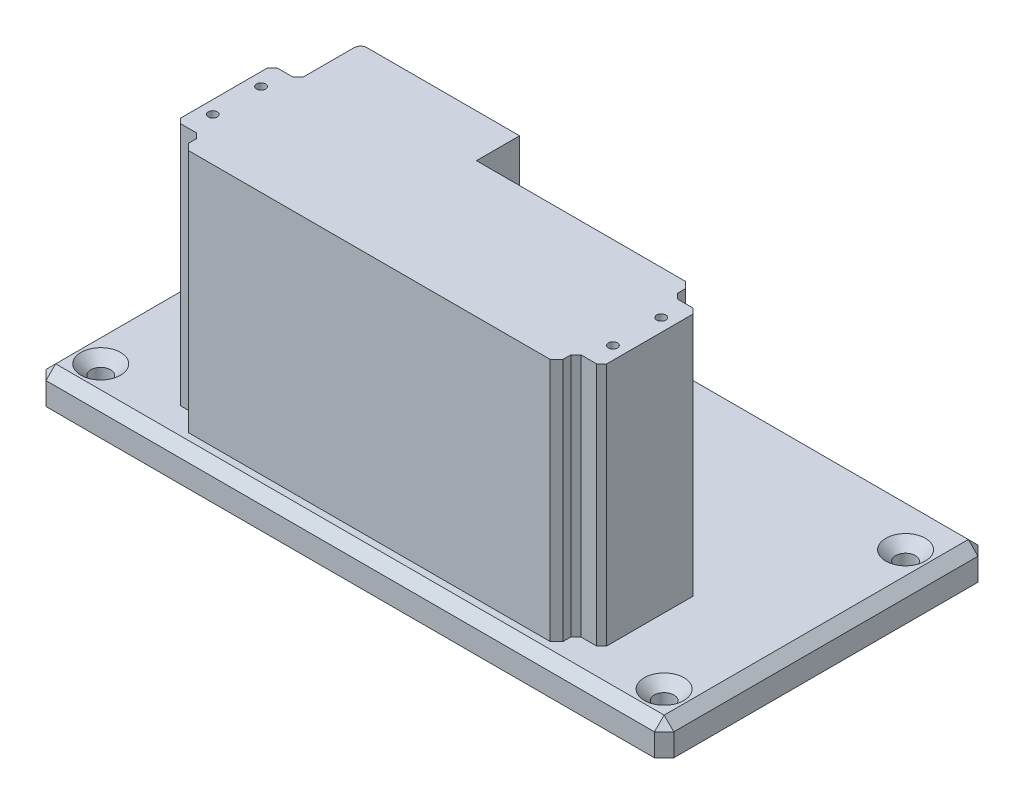
from build123d import *

# Parameters (mm, degrees)
SKETCH1_R           = 3.05
BOSS_EXTRUDE1_DEPTH = 10
BOSS_EXTRUDE2_DEPTH = 75.9
SKETCH3_R           = 1.4
CUT_EXTRUDE1_DEPTH  = 6
CHAMFER1_SIZE       = 1.55
CHAMFER2_SIZE       = 2
CHAMFER3_SIZE       = 3.1
CHAMFER4_SIZE       = 3


with BuildPart() as part:
    # Sketch1 → Boss-Extrude1 (new body)
    with BuildSketch(Plane(origin=(0, 0, 0), x_dir=(1, 0, 0), z_dir=(0, 1, 0))):
        Polygon((0, 0), (195, 0), (195, 95), (195, 100.5), (0, 100.5), (0, 95), align=None)
        with Locations(Location((10, 85, 0), (0, 0, 270))):
            Circle(SKETCH1_R, mode=Mode.SUBTRACT)
        with Locations(Location((185, 85, 0), (0, 0, 90))):
            Circle(SKETCH1_R, mode=Mode.SUBTRACT)
        with Locations(Location((185, 10, 0), (0, 0, 270))):
            Circle(SKETCH1_R, mode=Mode.SUBTRACT)
        with Locations(Location((10, 10, 0), (0, 0, 90))):
            Circle(SKETCH1_R, mode=Mode.SUBTRACT)
    extrude(amount=BOSS_EXTRUDE1_DEPTH)

    # Sketch2 → Boss-Extrude2 (add)
    with BuildSketch(Plane(origin=(0, 10, 0), x_dir=(1, 0, 0), z_dir=(0, 1, 0))):
        with BuildLine():
            Line((42.2, 60.5), (89.6, 60.5))
            Line((89.6, 60.5), (89.6, 47.1))
            Line((89.6, 47.1), (156.5, 47.1))
            Line((156.5, 47.1), (156.5, 41.1))
            Line((156.5, 41.1), (164.5, 41.1))
            Line((164.5, 41.1), (164.5, 11.1))
            Line((164.5, 11.1), (156.5, 11.1))
            Line((156.5, 11.1), (156.5, 5.1))
            Line((156.5, 5.1), (40.2, 5.1))
            Line((40.2, 5.1), (40.2, 11.1))
            Line((40.2, 11.1), (32.2, 11.1))
            Line((32.2, 11.1), (32.2, 41.1))
            Line((32.2, 41.1), (40.2, 41.1))
            Line((40.2, 41.1), (40.2, 58.5))
            ThreePointArc((40.2, 58.5), (40.785786438, 59.914213562), (42.2, 60.5))
        make_face()
    extrude(amount=BOSS_EXTRUDE2_DEPTH)

    # Sketch3 → Cut-Extrude1 (cut)
    with BuildSketch(Plane(origin=(0, 85.9, 0), x_dir=(1, 0, 0), z_dir=(0, 1, 0))):
        with Locations(Location((36.2, 33.6, 0), (0, 0, 270))):
            Circle(SKETCH3_R)
        with Locations(Location((36.2, 18.6, 0), (0, 0, 90))):
            Circle(SKETCH3_R)
        with Locations(Location((160.5, 18.6, 0), (0, 0, 270))):
            Circle(SKETCH3_R)
        with Locations(Location((160.5, 33.6, 0), (0, 0, 90))):
            Circle(SKETCH3_R)
    extrude(amount=-CUT_EXTRUDE1_DEPTH, mode=Mode.SUBTRACT)

    # Chamfer1
    chamfer1_edges = [part.edges().sort_by_distance(p)[0] for p in [
        (40.2, 47.95, -41.1),
        (32.2, 47.95, -41.1),
        (32.2, 47.95, -11.1),
        (40.2, 47.95, -11.1),
        (156.5, 47.95, -11.1),
        (164.5, 47.95, -11.1),
        (164.5, 47.95, -41.1),
        (156.5, 47.95, -41.1),
    ]]
    chamfer(chamfer1_edges, length=CHAMFER1_SIZE)

    # Chamfer2
    chamfer2_edges = [part.edges().sort_by_distance(p)[0] for p in [
        (40.2, 47.95, -5.1),
        (156.5, 47.95, -5.1),
        (156.5, 47.95, -47.1),
    ]]
    chamfer(chamfer2_edges, length=CHAMFER2_SIZE)

    # Chamfer3
    chamfer3_edges = [part.edges().sort_by_distance(p)[0] for p in [
        (10, 10, -88.05),
        (185, 10, -81.95),
        (185, 10, -13.05),
        (10, 10, -6.95),
    ]]
    chamfer(chamfer3_edges, length=CHAMFER3_SIZE)

    # Chamfer4
    chamfer4_edges = [part.edges().sort_by_distance(p)[0] for p in [
        (0, 5, -100.5),
        (195, 5, -100.5),
        (195, 5, 0),
        (0, 5, 0),
        (195, 10, -50.25),
        (97.5, 10, -100.5),
        (0, 10, -50.25),
        (97.5, 10, 0),
    ]]
    chamfer(chamfer4_edges, length=CHAMFER4_SIZE)


solid = part.part
